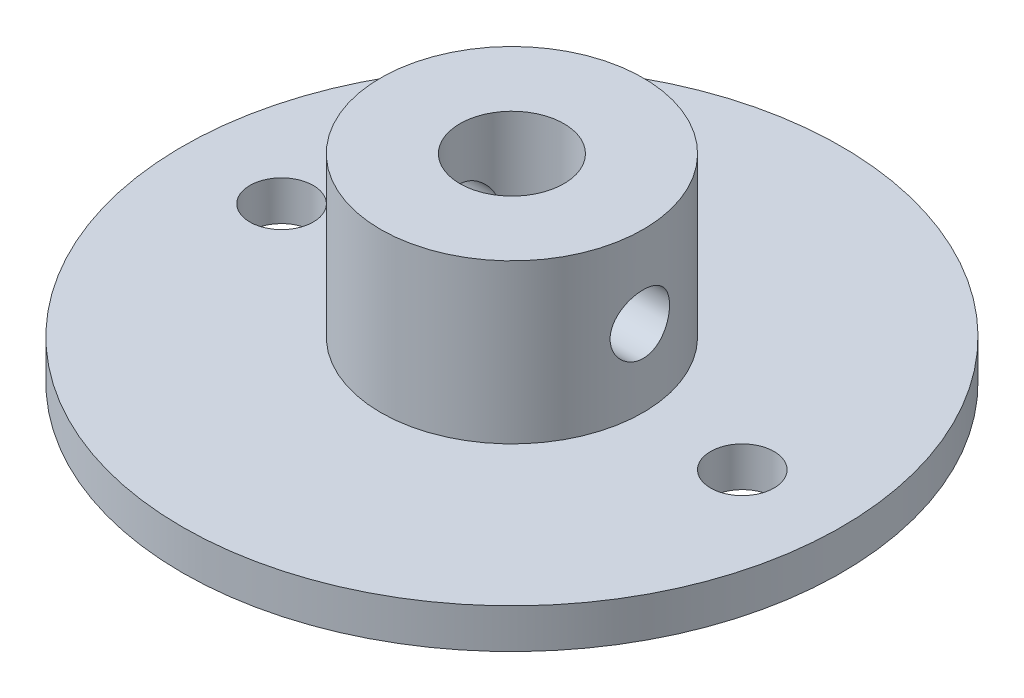
from build123d import *

# Parameters (mm, degrees)
SKETCH1_R               = 16.63
SKETCH1_R_2             = 4.8
SKETCH1_R_3             = 2.625
BOSS_EXTRUDE2_DEPTH     = 2
SKETCH5_R               = 6.625
SKETCH5_R_2             = 2.625
BOSS_EXTRUDE3_DEPTH     = 8
SKETCH4_R               = 1.6
CUT_EXTRUDE1_DEPTH      = 8
CIRPATTERN1_COUNT       = 2
CUT_EXTRUDE2_DEPTH      = 10
CUT_EXTRUDE2_DEPTH_BACK = 8
SKETCH6_R               = 1.5


with BuildPart() as part:
    # Sketch1 → Boss-Extrude2 (new body)
    # profile 1 of 2: a face of its own
    with BuildSketch(Plane(origin=(0, 0, 0), x_dir=(1, 0, 0), z_dir=(0, 1, 0))):
        with Locations(Location((0, 0, 0), (0, 0, 270))):
            Circle(SKETCH1_R)
        Circle(SKETCH1_R_2, mode=Mode.SUBTRACT)
    # profile 2 of 2: a face of its own
    with BuildSketch(Plane(origin=(0, 0, 0), x_dir=(1, 0, 0), z_dir=(0, 1, 0))):
        Circle(SKETCH1_R_2)
        with Locations(Location((0, 0, 0), (0, 0, 270))):
            Circle(SKETCH1_R_3, mode=Mode.SUBTRACT)
    extrude(amount=BOSS_EXTRUDE2_DEPTH)

    # Sketch5 → Boss-Extrude3 (add)
    with BuildSketch(Plane(origin=(0, 2, 0), x_dir=(1, 0, 0), z_dir=(0, 1, 0))):
        with Locations(Location((0, 0, 0), (0, 0, 270))):
            Circle(SKETCH5_R)
        with Locations(Location((0, 0, 0), (0, 0, 270))):
            Circle(SKETCH5_R_2, mode=Mode.SUBTRACT)
    extrude(amount=BOSS_EXTRUDE3_DEPTH)

    # Sketch4 → Cut-Extrude1 (cut)
    with BuildSketch(Plane(origin=(0, 2, 0), x_dir=(1, 0, 0), z_dir=(0, 1, 0))):
        with Locations(Location((11.625, 0, 0), (0, 0, 270))):
            Circle(SKETCH4_R)
    cut_extrude1 = extrude(amount=-CUT_EXTRUDE1_DEPTH, mode=Mode.SUBTRACT)

    # CirPattern1: Cut-Extrude1 ×2 about axis
    cirpattern1_axis = Axis((0, 0, 0), (0, 1, 0))
    for i in range(1, CIRPATTERN1_COUNT):
        add(cut_extrude1.rotate(cirpattern1_axis, i * 360 / CIRPATTERN1_COUNT), mode=Mode.SUBTRACT)

    # Sketch6 → Cut-Extrude2 (cut, two sides: drawn at the far end of the back side and taken through both)
    with BuildSketch(Plane(origin=(0, 0, 0), x_dir=(0, 0, -1), z_dir=(1, 0, 0)).offset(-CUT_EXTRUDE2_DEPTH_BACK)):
        with Locations(Location((0, 5.866356901, 0), (0, 0, 180))):
            Circle(SKETCH6_R)
    extrude(amount=CUT_EXTRUDE2_DEPTH + CUT_EXTRUDE2_DEPTH_BACK, mode=Mode.SUBTRACT)


solid = part.part
